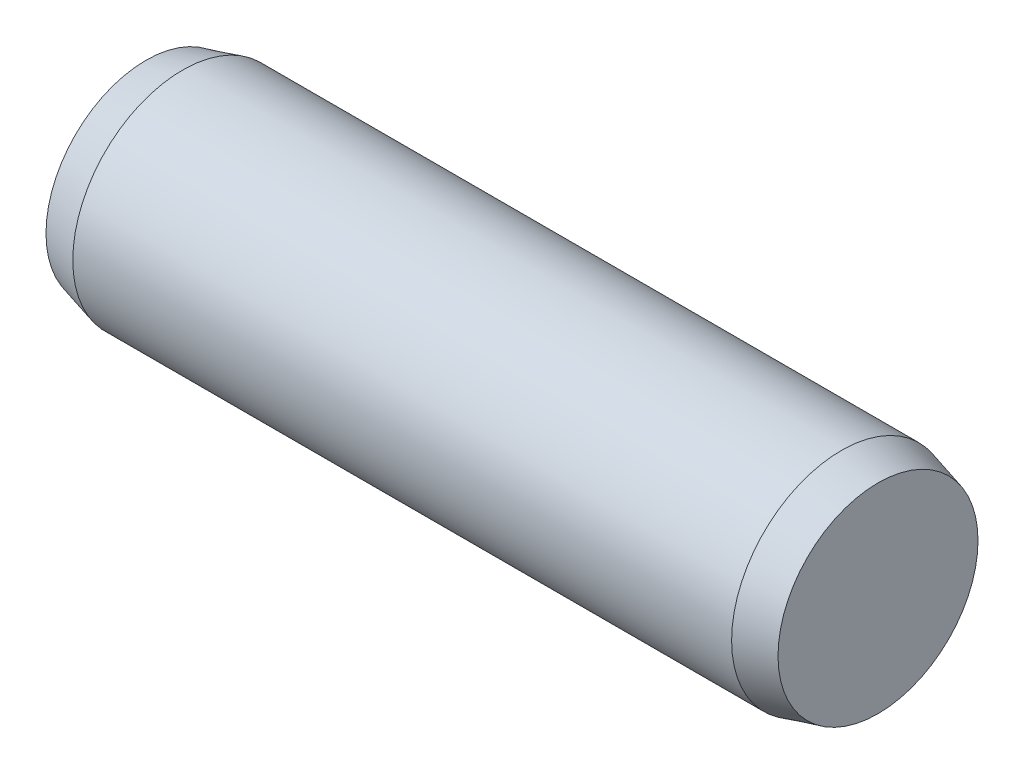
from build123d import *


with BuildPart() as part:
    # Sketch1 → Base-Revolve (revolve)
    with BuildSketch(Plane.XY, mode=Mode.PRIVATE) as base_revolve_sk:
        Polygon((0, 0), (10, 0), (10, 1.366025404), (9.5, 1.5), (0.5, 1.5), (0, 1.366025404), align=None)
    revolve(base_revolve_sk.sketch.rotate(Axis((-6.976683678, 0, 0), (1, 0, 0)), 90), axis=Axis((-6.976683678, 0, 0), (1, 0, 0)))


solid = part.part
